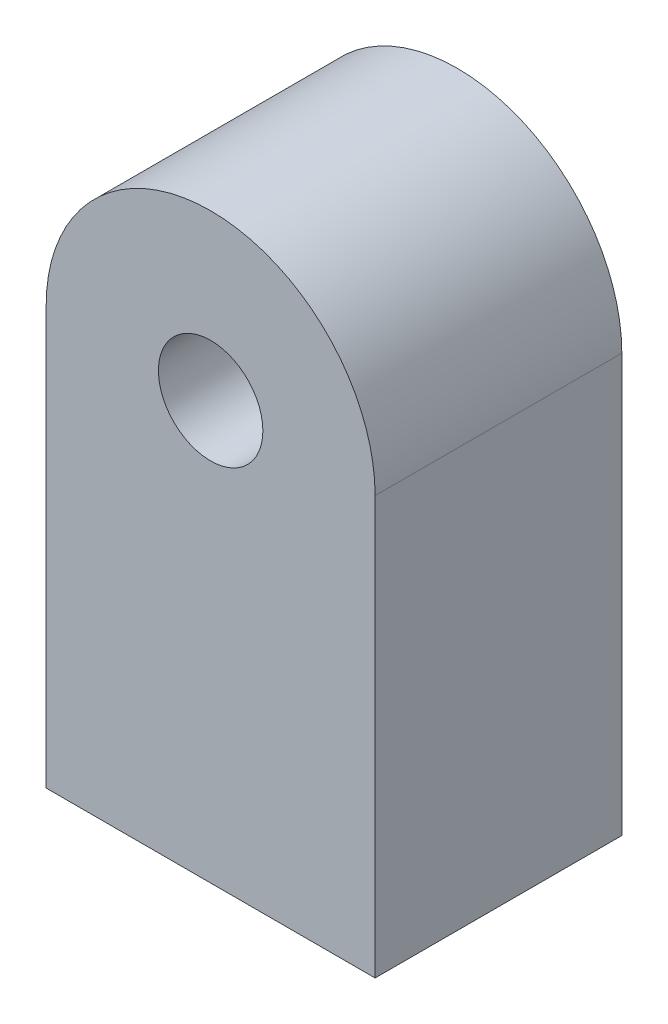
from build123d import *

# Parameters (mm, degrees)
SKETCH1_R           = 3.175
BOSS_EXTRUDE1_DEPTH = 15
SKETCH2_R           = 3.175
CUT_EXTRUDE1_DEPTH  = 15


with BuildPart() as part:
    # Sketch1 → Boss-Extrude1 (new body)
    with BuildSketch(Plane.XY):
        with BuildLine():
            Line((-10, 0), (-10, -25.4))
            Line((-10, -25.4), (10, -25.4))
            Line((10, -25.4), (10, 0))
            ThreePointArc((10, 0), (0, 10), (-10, 0))
        make_face()
        Circle(SKETCH1_R, mode=Mode.SUBTRACT)
    extrude(amount=BOSS_EXTRUDE1_DEPTH)

    # Sketch2 → Cut-Extrude1 (cut)
    with BuildSketch(Plane.XZ.offset(25.4)):
        with Locations(Location((0, 7.5, 0), (0, 0, 270))):
            Circle(SKETCH2_R)
    extrude(amount=-CUT_EXTRUDE1_DEPTH, mode=Mode.SUBTRACT)


solid = part.part
